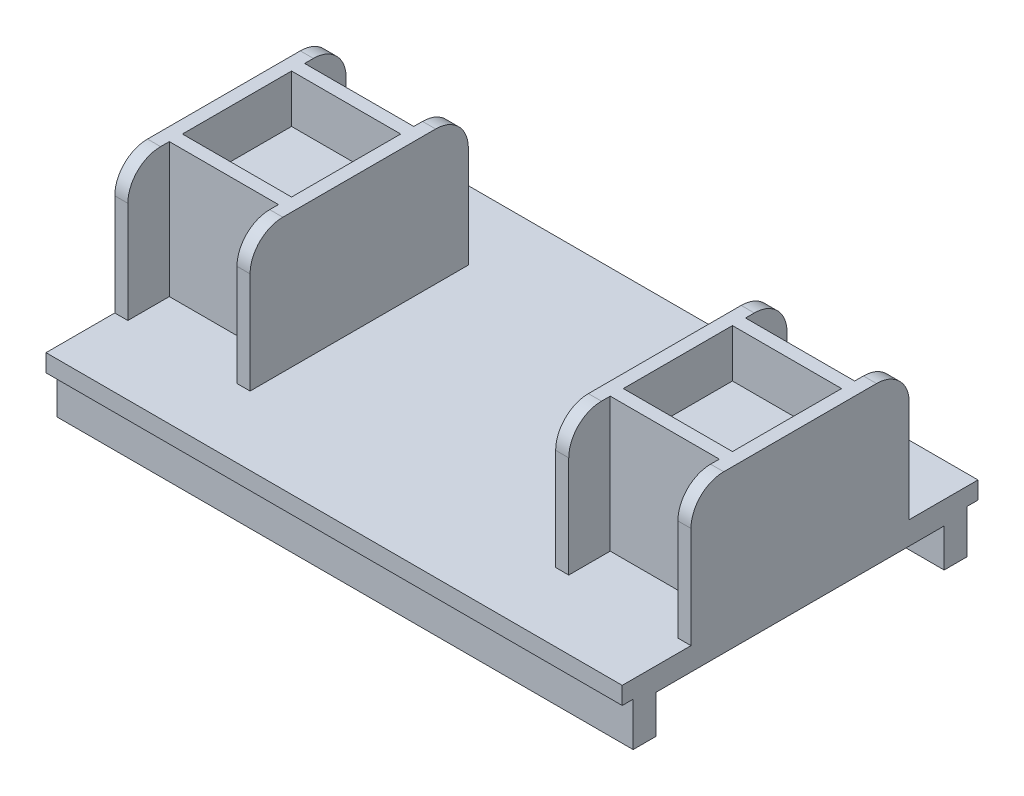
from build123d import *

# Parameters (mm, degrees)
SKETCH_1_W             = 528
SKETCH_1_H             = 326
EXTRUDE_1_DEPTH        = 16
SKETCH_2_W             = 528
SKETCH_2_H             = 16
EXTRUDE_2_DEPTH        = 40
EXTRUDE_3_DEPTH        = 528
EXTRUDE_4_DEPTH        = 12
PATTERN_LINEAR_1_COUNT = 2
PATTERN_LINEAR_1_PITCH = 112
SKETCH_5_W             = 100
SKETCH_5_H             = 12
EXTRUDE_5_DEPTH        = 123
SKETCH_6_W             = 100
SKETCH_6_H             = 12
EXTRUDE_6_DEPTH        = 100
MIRROR_2_COPY_1_DEPTH  = 12


with BuildPart() as part:
    # 草图1 → 凸台-拉伸1 (new body)
    with BuildSketch(Plane(origin=(0, 0, 0), x_dir=(1, 0, 0), z_dir=(0, 1, 0))):
        Rectangle(SKETCH_1_W, SKETCH_1_H)
    extrude(amount=EXTRUDE_1_DEPTH)

    # 草图2 → 凸台-拉伸2 (add)
    with BuildSketch(Plane.XZ):
        with Locations((0, 145)):
            Rectangle(SKETCH_2_W, SKETCH_2_H)
        with Locations((0, -145)):
            Rectangle(SKETCH_2_W, SKETCH_2_H)
    extrude(amount=EXTRUDE_2_DEPTH)

    # 草图3 → 凸台-拉伸3 (add)
    with BuildSketch(Plane(origin=(264, 0, 0), x_dir=(0, 0, -1), z_dir=(1, 0, 0))):
        Polygon((-137, -40), (-137, 0), (137, 0), (137, -40), (132, -40), (132, -5), (-132, -5), (-132, -40), align=None)
    extrude(amount=-EXTRUDE_3_DEPTH)

    # 草图4 → 凸台-拉伸4 (add)
    with BuildSketch(Plane.ZY.offset(264)):
        with BuildLine():
            Line((-70, 139), (70, 139))
            ThreePointArc((70, 139), (91.213203436, 130.213203436), (100, 109))
            Line((100, 109), (100, 16))
            Line((100, 16), (-100, 16))
            Line((-100, 16), (-100, 109))
            ThreePointArc((-100, 109), (-91.213203436, 130.213203436), (-70, 139))
        make_face()
    extrude_4 = extrude(amount=-EXTRUDE_4_DEPTH)

    # 阵列(线性)1: 凸台-拉伸4 ×2
    with Locations(*[(i * PATTERN_LINEAR_1_PITCH, 0, 0) for i in range(1, PATTERN_LINEAR_1_COUNT)]):
        add(extrude_4)

    # 草图5 → 凸台-拉伸5 (add)
    with BuildSketch(Plane(origin=(0, 16, 0), x_dir=(1, 0, 0), z_dir=(0, 1, 0))):
        with Locations((-202, 56)):
            Rectangle(SKETCH_5_W, SKETCH_5_H)
        with Locations((-202, -56)):
            Rectangle(SKETCH_5_W, SKETCH_5_H)
    extrude_5 = extrude(amount=EXTRUDE_5_DEPTH)

    # 草图6 → 凸台-拉伸6 (add)
    with BuildSketch(Plane.ZY.offset(152)):
        with Locations((0, 89)):
            Rectangle(SKETCH_6_W, SKETCH_6_H)
    extrude_6 = extrude(amount=EXTRUDE_6_DEPTH)

    # 镜向2: 凸台-拉伸4, 凸台-拉伸5, 凸台-拉伸6 across plane
    add(extrude_4.mirror(Plane(origin=(0, 0, 0), x_dir=(0, 0, 1), z_dir=(1, 0, 0))))
    add(extrude_5.mirror(Plane(origin=(0, 0, 0), x_dir=(0, 0, 1), z_dir=(1, 0, 0))))
    add(extrude_6.mirror(Plane(origin=(0, 0, 0), x_dir=(0, 0, 1), z_dir=(1, 0, 0))))

    # 镜向2 copy 1 sketch → 镜向2 copy 1 (add)
    with BuildSketch(Plane(origin=(152, 0, 0), x_dir=(0, 0, 1), z_dir=(1, 0, 0))):
        with BuildLine():
            Line((-70, -139), (70, -139))
            ThreePointArc((70, -139), (91.213203436, -130.213203436), (100, -109))
            Line((100, -109), (100, -16))
            Line((100, -16), (-100, -16))
            Line((-100, -16), (-100, -109))
            ThreePointArc((-100, -109), (-91.213203436, -130.213203436), (-70, -139))
        make_face()
    extrude(amount=-MIRROR_2_COPY_1_DEPTH)


solid = part.part
